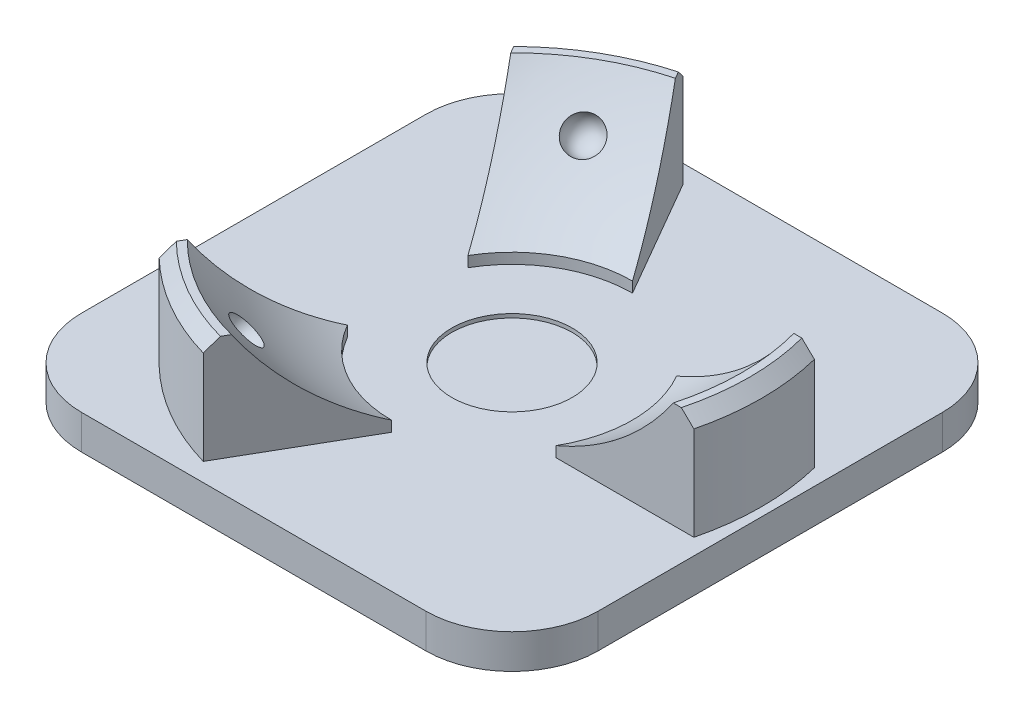
from build123d import *

# Parameters (mm, degrees)
CUT_EXTRUDE_1_DEPTH      = 43.811678643
PATTERN_CIRCULAR_5_COUNT = 3
EXTRUDE_1_DEPTH          = 4
SKETCH_5_R               = 14
CUT_EXTRUDE_2_DEPTH      = 45.179631373
SKETCH_6_R               = 7
CUT_EXTRUDE_3_DEPTH      = 45.17963138
SKETCH_7_W               = 30.2
SKETCH_7_H               = 16.2
CUT_EXTRUDE_4_DEPTH      = 3.35
EXTRUDE_START            = -0.2
SKETCH_8_R               = 7
EXTRUDE_2_DEPTH          = 0.2


with BuildPart() as part:
    # Эскиз1 → Повернуть1 (revolve)
    with BuildSketch(Plane.XY):
        with BuildLine():
            Line((11.135528726, 0), (28.991378029, 0))
            Line((28.991378029, 0), (28.991378029, 10.908116908))
            Line((28.991378029, 10.908116908), (27.577164466, 12.32233047))
            Line((27.577164466, 12.32233047), (26.673957337, 12.32233047))
            ThreePointArc((26.673957337, 12.32233047), (19.883391716, 4.927091635), (11.135528726, 0))
        make_face()
    revolve(axis=Axis((0, 0, 0), (0, 1, 0)))

    # Эскиз2 → Вырез-Вытянуть1 (cut, through all)
    with BuildSketch(Plane.XZ):
        with BuildLine():
            Line((4.04141358, 7), (4.04141358, -7))
            Line((4.04141358, -7), (34.14370091, -7))
            ThreePointArc((34.14370091, -7), (-34.85387083, 0), (34.14370091, 7))
            Line((34.14370091, 7), (28.133609793, 7))
            Line((28.133609793, 7), (4.04141358, 7))
        make_face()
    extrude(amount=-CUT_EXTRUDE_1_DEPTH, mode=Mode.SUBTRACT)

    # Эскиз3 → Вырез-Повернуть3 (revolve, cut)
    with BuildSketch(Plane.XY):
        with BuildLine():
            Line((21.213203436, 8.786796564), (24.04163056, 5.95836944))
            ThreePointArc((24.04163056, 5.95836944), (21.213203436, 5.95836944), (21.213203436, 8.786796564))
        make_face()
    revolve(axis=Axis((0, 30, 0), (0.7071067811865439, -0.7071067811865512, 0)), mode=Mode.SUBTRACT)


with BuildPart() as pattern_circular_5_1:
    # Круговой массив5: pattern copy
    add(part.part.rotate(Axis((0, 0, 0), (0, 1, 0)), 1 * 360 / PATTERN_CIRCULAR_5_COUNT))


with BuildPart() as pattern_circular_5_2:
    # Круговой массив5: pattern copy
    add(part.part.rotate(Axis((0, 0, 0), (0, 1, 0)), 2 * 360 / PATTERN_CIRCULAR_5_COUNT))


with BuildPart() as part_1:
    add(part.part)

    add(pattern_circular_5_1.part)  # Бобышка-Вытянуть1 merges Круговой массив5_1

    add(pattern_circular_5_2.part)  # Бобышка-Вытянуть1 merges Круговой массив5_2
    # Эскиз4 → Бобышка-Вытянуть1 (add)
    with BuildSketch(Plane.XZ):
        with BuildLine():
            Line((-20, -30), (20, -30))
            ThreePointArc((20, -30), (27.071067812, -27.071067812), (30, -20))
            Line((30, -20), (30, 20))
            ThreePointArc((30, 20), (27.071067812, 27.071067812), (20, 30))
            Line((20, 30), (-20, 30))
            ThreePointArc((-20, 30), (-27.071067812, 27.071067812), (-30, 20))
            Line((-30, 20), (-30, -20))
            ThreePointArc((-30, -20), (-27.071067812, -27.071067812), (-20, -30))
        make_face()
    extrude(amount=EXTRUDE_1_DEPTH)

    # Эскиз5 → Вырез-Вытянуть2 (cut, through all)
    with BuildSketch(Plane(origin=(0, 0, 0), x_dir=(1, 0, 0), z_dir=(0, 1, 0))):
        Circle(SKETCH_5_R)
    extrude(amount=CUT_EXTRUDE_2_DEPTH, mode=Mode.SUBTRACT)

    # Эскиз6 → Вырез-Вытянуть3 (cut, through all)
    with BuildSketch(Plane(origin=(0, 0, 0), x_dir=(1, 0, 0), z_dir=(0, 1, 0))):
        Circle(SKETCH_6_R)
    extrude(amount=-CUT_EXTRUDE_3_DEPTH, mode=Mode.SUBTRACT)

    # Эскиз7 → Вырез-Вытянуть4 (cut)
    with BuildSketch(Plane.XZ.offset(4)):
        with Locations((1, 0)):
            Rectangle(SKETCH_7_W, SKETCH_7_H)
    extrude(amount=-CUT_EXTRUDE_4_DEPTH, mode=Mode.SUBTRACT)

    # Эскиз8 → Бобышка-Вытянуть2 (add)
    with BuildSketch(Plane.XZ.offset(0.65).offset(EXTRUDE_START)):
        Circle(SKETCH_8_R)
    extrude(amount=EXTRUDE_2_DEPTH)


solid = part_1.part
